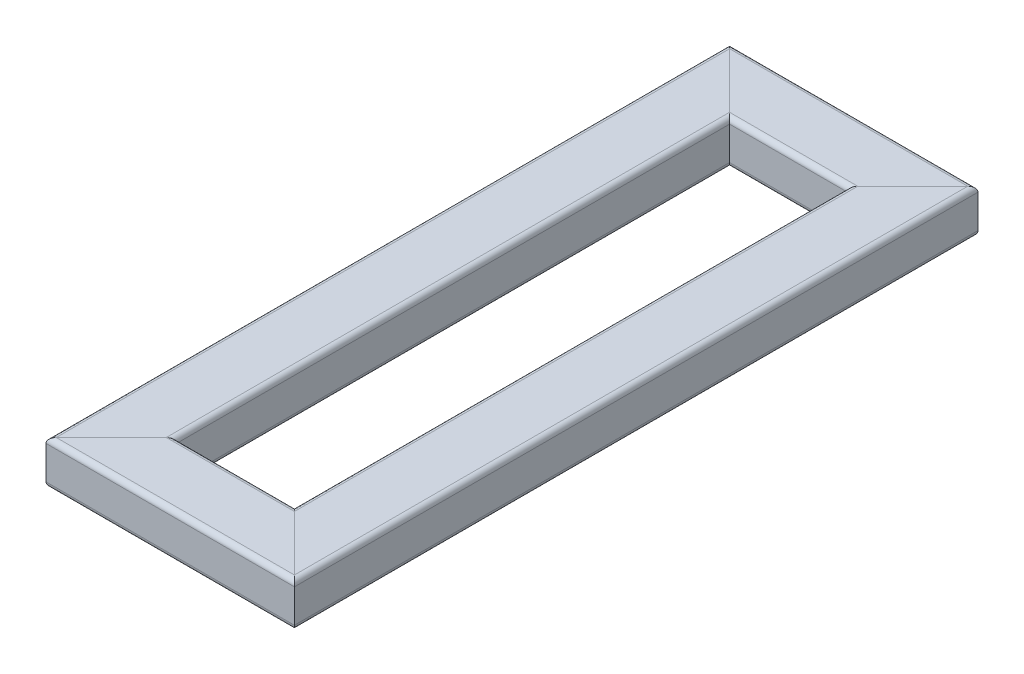
from build123d import *

# Parameters (mm, degrees)
TUBO_RECTANGULAR_3_X_2_X_0_25_1_DEPTH      = 890.581002397
TUBO_RECTANGULAR_3_X_2_X_0_25_1_DEPTH_BACK = 92.581002397
TUBO_RECTANGULAR_3_X_2_X_0_25_1_2_DEPTH    = 475.162004794
TUBO_RECTANGULAR_3_X_2_X_0_25_1_3_DEPTH    = 983.162004794
TUBO_RECTANGULAR_3_X_2_X_0_25_1_4_DEPTH    = 475.162004794


with BuildPart() as part:
    # Sketch1 → Tubo rectangular 3 X 2 X 0.25(1) (new, two sides: drawn at the far end of the back side and taken through both)
    with BuildSketch(Plane(origin=(-106.9, 25.4, -399), x_dir=(1, 0, 0), z_dir=(0, 0, 1)).offset(-TUBO_RECTANGULAR_3_X_2_X_0_25_1_DEPTH_BACK)):
        with BuildLine():
            Line((-32.1, -25.4), (32.1, -25.4))
            ThreePointArc((32.1, -25.4), (36.342640687, -23.642640687), (38.1, -19.4))
            Line((38.1, -19.4), (38.1, 19.4))
            ThreePointArc((38.1, 19.4), (36.342640687, 23.642640687), (32.1, 25.4))
            Line((32.1, 25.4), (-32.1, 25.4))
            ThreePointArc((-32.1, 25.4), (-36.342640687, 23.642640687), (-38.1, 19.4))
            Line((-38.1, 19.4), (-38.1, -19.4))
            ThreePointArc((-38.1, -19.4), (-36.342640687, -23.642640687), (-32.1, -25.4))
        make_face()
        with BuildLine():
            Line((-32.1, -22.4), (32.1, -22.4))
            ThreePointArc((32.1, -22.4), (34.221320344, -21.521320344), (35.1, -19.4))
            Line((35.1, -19.4), (35.1, 19.4))
            ThreePointArc((35.1, 19.4), (34.221320344, 21.521320344), (32.1, 22.4))
            Line((32.1, 22.4), (-32.1, 22.4))
            ThreePointArc((-32.1, 22.4), (-34.221320344, 21.521320344), (-35.1, 19.4))
            Line((-35.1, 19.4), (-35.1, -19.4))
            ThreePointArc((-35.1, -19.4), (-34.221320344, -21.521320344), (-32.1, -22.4))
        make_face(mode=Mode.SUBTRACT)
    extrude(amount=TUBO_RECTANGULAR_3_X_2_X_0_25_1_DEPTH + TUBO_RECTANGULAR_3_X_2_X_0_25_1_DEPTH_BACK)

    # Tubo rectangular 3 X 2 X 0.25(1) mitre 1
    split(bisect_by=Plane(origin=(-145, 0, -399), x_dir=(0, -1, 0), z_dir=(-0.707106781, 0, 0.707106781)), keep=Keep.TOP)

    # Tubo rectangular 3 X 2 X 0.25(1) mitre 2
    split(bisect_by=Plane(origin=(-145, 0, 399), x_dir=(0, -1, 0), z_dir=(-0.707106781, 0, -0.707106781)), keep=Keep.TOP)


with BuildPart() as body_2:
    # Sketch1 on segment 2 (carried to segment 2) → Tubo rectangular 3 X 2 X 0.25_1 2 (new body)
    with BuildSketch(Plane(origin=(-237.581002397, 25.4, 360.9), x_dir=(0, 0, -1), z_dir=(1, 0, 0))):
        with BuildLine():
            Line((-32.1, -25.4), (32.1, -25.4))
            ThreePointArc((32.1, -25.4), (36.342640687, -23.642640687), (38.1, -19.4))
            Line((38.1, -19.4), (38.1, 19.4))
            ThreePointArc((38.1, 19.4), (36.342640687, 23.642640687), (32.1, 25.4))
            Line((32.1, 25.4), (-32.1, 25.4))
            ThreePointArc((-32.1, 25.4), (-36.342640687, 23.642640687), (-38.1, 19.4))
            Line((-38.1, 19.4), (-38.1, -19.4))
            ThreePointArc((-38.1, -19.4), (-36.342640687, -23.642640687), (-32.1, -25.4))
        make_face()
        with BuildLine():
            Line((-32.1, -22.4), (32.1, -22.4))
            ThreePointArc((32.1, -22.4), (34.221320344, -21.521320344), (35.1, -19.4))
            Line((35.1, -19.4), (35.1, 19.4))
            ThreePointArc((35.1, 19.4), (34.221320344, 21.521320344), (32.1, 22.4))
            Line((32.1, 22.4), (-32.1, 22.4))
            ThreePointArc((-32.1, 22.4), (-34.221320344, 21.521320344), (-35.1, 19.4))
            Line((-35.1, 19.4), (-35.1, -19.4))
            ThreePointArc((-35.1, -19.4), (-34.221320344, -21.521320344), (-32.1, -22.4))
        make_face(mode=Mode.SUBTRACT)
    extrude(amount=TUBO_RECTANGULAR_3_X_2_X_0_25_1_2_DEPTH)

    # Tubo rectangular 3 X 2 X 0.25_1 2 mitre
    split(bisect_by=Plane(origin=(-145, 0, 399), x_dir=(0, 1, 0), z_dir=(0.707106781, 0, 0.707106781)), keep=Keep.TOP)

    # Tubo rectangular 3 X 2 X 0.25_1 2 mi 2
    split(bisect_by=Plane(origin=(145, 0, 399), x_dir=(0, -1, 0), z_dir=(-0.707106781, 0, 0.707106781)), keep=Keep.TOP)


with BuildPart() as body_3:
    # Sketch1 on segment 3 (carried to segment 3) → Tubo rectangular 3 X 2 X 0.25_1 3 (new body)
    with BuildSketch(Plane(origin=(106.9, 25.4, 491.581002397), x_dir=(-1, 0, 0), z_dir=(0, 0, -1))):
        with BuildLine():
            Line((-32.1, -25.4), (32.1, -25.4))
            ThreePointArc((32.1, -25.4), (36.342640687, -23.642640687), (38.1, -19.4))
            Line((38.1, -19.4), (38.1, 19.4))
            ThreePointArc((38.1, 19.4), (36.342640687, 23.642640687), (32.1, 25.4))
            Line((32.1, 25.4), (-32.1, 25.4))
            ThreePointArc((-32.1, 25.4), (-36.342640687, 23.642640687), (-38.1, 19.4))
            Line((-38.1, 19.4), (-38.1, -19.4))
            ThreePointArc((-38.1, -19.4), (-36.342640687, -23.642640687), (-32.1, -25.4))
        make_face()
        with BuildLine():
            Line((-32.1, -22.4), (32.1, -22.4))
            ThreePointArc((32.1, -22.4), (34.221320344, -21.521320344), (35.1, -19.4))
            Line((35.1, -19.4), (35.1, 19.4))
            ThreePointArc((35.1, 19.4), (34.221320344, 21.521320344), (32.1, 22.4))
            Line((32.1, 22.4), (-32.1, 22.4))
            ThreePointArc((-32.1, 22.4), (-34.221320344, 21.521320344), (-35.1, 19.4))
            Line((-35.1, 19.4), (-35.1, -19.4))
            ThreePointArc((-35.1, -19.4), (-34.221320344, -21.521320344), (-32.1, -22.4))
        make_face(mode=Mode.SUBTRACT)
    extrude(amount=TUBO_RECTANGULAR_3_X_2_X_0_25_1_3_DEPTH)

    # Tubo rectangular 3 X 2 X 0.25_1 3 mitre
    split(bisect_by=Plane(origin=(145, 0, -399), x_dir=(0, 1, 0), z_dir=(0.707106781, 0, 0.707106781)), keep=Keep.TOP)

    # Tubo rectangular 3 X 2 X 0.25_1 3 mi 2
    split(bisect_by=Plane(origin=(145, 0, 399), x_dir=(0, 1, 0), z_dir=(0.707106781, 0, -0.707106781)), keep=Keep.TOP)


with BuildPart() as body_4:
    # Sketch1 on segment 4 (carried to segment 4) → Tubo rectangular 3 X 2 X 0.25_1 4 (new body)
    with BuildSketch(Plane(origin=(237.581002397, 25.4, -360.9), x_dir=(0, 0, 1), z_dir=(-1, 0, 0))):
        with BuildLine():
            Line((-32.1, -25.4), (32.1, -25.4))
            ThreePointArc((32.1, -25.4), (36.342640687, -23.642640687), (38.1, -19.4))
            Line((38.1, -19.4), (38.1, 19.4))
            ThreePointArc((38.1, 19.4), (36.342640687, 23.642640687), (32.1, 25.4))
            Line((32.1, 25.4), (-32.1, 25.4))
            ThreePointArc((-32.1, 25.4), (-36.342640687, 23.642640687), (-38.1, 19.4))
            Line((-38.1, 19.4), (-38.1, -19.4))
            ThreePointArc((-38.1, -19.4), (-36.342640687, -23.642640687), (-32.1, -25.4))
        make_face()
        with BuildLine():
            Line((-32.1, -22.4), (32.1, -22.4))
            ThreePointArc((32.1, -22.4), (34.221320344, -21.521320344), (35.1, -19.4))
            Line((35.1, -19.4), (35.1, 19.4))
            ThreePointArc((35.1, 19.4), (34.221320344, 21.521320344), (32.1, 22.4))
            Line((32.1, 22.4), (-32.1, 22.4))
            ThreePointArc((-32.1, 22.4), (-34.221320344, 21.521320344), (-35.1, 19.4))
            Line((-35.1, 19.4), (-35.1, -19.4))
            ThreePointArc((-35.1, -19.4), (-34.221320344, -21.521320344), (-32.1, -22.4))
        make_face(mode=Mode.SUBTRACT)
    extrude(amount=TUBO_RECTANGULAR_3_X_2_X_0_25_1_4_DEPTH)

    # Tubo rectangular 3 X 2 X 0.25_1 4 mitre
    split(bisect_by=Plane(origin=(-145, 0, -399), x_dir=(0, 1, 0), z_dir=(0.707106781, 0, -0.707106781)), keep=Keep.TOP)

    # Tubo rectangular 3 X 2 X 0.25_1 4 mi 2
    split(bisect_by=Plane(origin=(145, 0, -399), x_dir=(0, -1, 0), z_dir=(-0.707106781, 0, -0.707106781)), keep=Keep.TOP)


solid = Compound([part.part, body_2.part, body_3.part, body_4.part])
